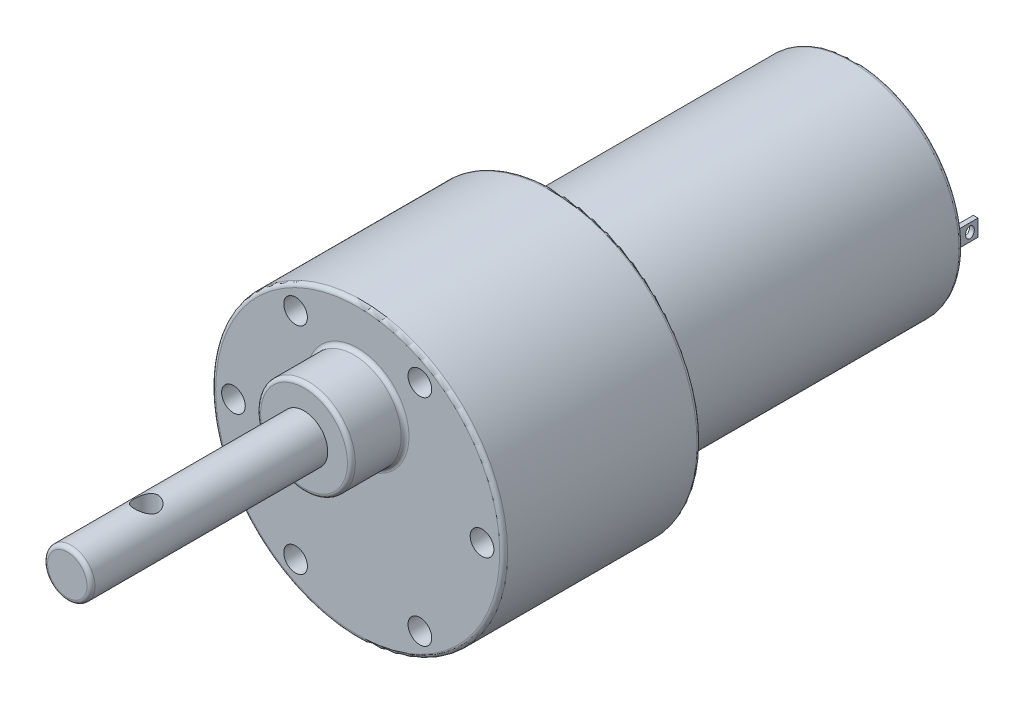
from build123d import *

# Parameters (mm, degrees)
SKETCH1_R           = 18.5
BOSS_EXTRUDE1_DEPTH = 25
SKETCH2_R           = 6
BOSS_EXTRUDE2_DEPTH = 6.8
SKETCH3_R           = 3
BOSS_EXTRUDE3_DEPTH = 30
SKETCH4_R           = 13.7
BOSS_EXTRUDE4_DEPTH = 38
SKETCH5_R           = 5
BOSS_EXTRUDE5_DEPTH = 2
SKETCH6_R           = 1.5
BOSS_EXTRUDE6_DEPTH = 1
SKETCH7_W           = 0.6
SKETCH7_H           = 2.112909024
BOSS_EXTRUDE7_DEPTH = 3
SKETCH9_RX          = 0.703104286
SKETCH9_RY          = 0.549037665
CUT_EXTRUDE1_DEPTH  = 3
SKETCH10_RX         = 0.71543089
SKETCH10_RY         = 0.482234279
CUT_EXTRUDE2_DEPTH  = 3
SKETCH11_R          = 1.5
CUT_EXTRUDE3_DEPTH  = 68.109909849
SKETCH12_R          = 1.5
CUT_EXTRUDE4_DEPTH  = 3
FILLET1_R           = 0.5
FILLET2_R           = 0.5
FILLET3_R           = 0.5
FILLET4_R           = 0.5
FILLET5_R           = 0.5


with BuildPart() as part:
    # Sketch1 → Boss-Extrude1 (new body)
    with BuildSketch(Plane.XY):
        Circle(SKETCH1_R)
    extrude(amount=BOSS_EXTRUDE1_DEPTH)

    # Sketch2 → Boss-Extrude2 (add)
    with BuildSketch(Plane.XY.offset(25)):
        with Locations((0, 7)):
            Circle(SKETCH2_R)
    extrude(amount=BOSS_EXTRUDE2_DEPTH)

    # Sketch3 → Boss-Extrude3 (add)
    with BuildSketch(Plane.XY.offset(31.8)):
        with Locations((0, 7)):
            Circle(SKETCH3_R)
    extrude(amount=BOSS_EXTRUDE3_DEPTH)

    # Sketch4 → Boss-Extrude4 (add)
    with BuildSketch(Plane(origin=(0, 0, 0), x_dir=(-1, 0, 0), z_dir=(0, 0, -1))):
        with Locations(Location((0, 0, 0), (0, 0, 180))):
            Circle(SKETCH4_R)
    extrude(amount=BOSS_EXTRUDE4_DEPTH)

    # Sketch5 → Boss-Extrude5 (add)
    with BuildSketch(Plane(origin=(0, 0, -38), x_dir=(-1, 0, 0), z_dir=(0, 0, -1))):
        Circle(SKETCH5_R)
    extrude(amount=BOSS_EXTRUDE5_DEPTH)

    # Sketch6 → Boss-Extrude6 (add)
    with BuildSketch(Plane(origin=(0, 0, -40), x_dir=(-1, 0, 0), z_dir=(0, 0, -1))):
        Circle(SKETCH6_R)
    extrude(amount=BOSS_EXTRUDE6_DEPTH)

    # Sketch7 → Boss-Extrude7 (add)
    with BuildSketch(Plane(origin=(0, 0, -38), x_dir=(-1, 0, 0), z_dir=(0, 0, -1))):
        with Locations((-12.3, 0)):
            Rectangle(SKETCH7_W, SKETCH7_H)
        with Locations((12.3, 0)):
            Rectangle(SKETCH7_W, SKETCH7_H)
    extrude(amount=BOSS_EXTRUDE7_DEPTH)

    # Sketch9 → Cut-Extrude1 (cut)
    with BuildSketch(Plane(origin=(12.6, 0, 0), x_dir=(0, 0, -1), z_dir=(1, 0, 0))):
        with Locations(Location((39.979491876, 0), (0, 0, 90))):
            Ellipse(SKETCH9_RX, SKETCH9_RY)
    extrude(amount=-CUT_EXTRUDE1_DEPTH, mode=Mode.SUBTRACT)

    # Sketch10 → Cut-Extrude2 (cut)
    with BuildSketch(Plane.ZY.offset(12.6)):
        with Locations(Location((-39.916631896, 0), (0, 0, 90))):
            Ellipse(SKETCH10_RX, SKETCH10_RY)
    extrude(amount=-CUT_EXTRUDE2_DEPTH, mode=Mode.SUBTRACT)

    # Sketch11 → Cut-Extrude3 (cut, through all)
    with BuildSketch(Plane(origin=(0, 0, 0), x_dir=(1, 0, 0), z_dir=(0, 1, 0))):
        with Locations(Location((0, -51.8, 0), (0, 0, 90))):
            Circle(SKETCH11_R)
    extrude(amount=CUT_EXTRUDE3_DEPTH, mode=Mode.SUBTRACT)

    # Sketch12 → Cut-Extrude4 (cut)
    with BuildSketch(Plane.XY.offset(25)):
        with Locations((-15.749852276, 0)):
            Circle(SKETCH12_R)
        with Locations((-7.874852276, 13.63990011)):
            Circle(SKETCH12_R)
        with Locations((7.875147724, 13.63990011)):
            Circle(SKETCH12_R)
        with Locations((15.750147724, 0)):
            Circle(SKETCH12_R)
        with Locations((7.875147724, -13.63990011)):
            Circle(SKETCH12_R)
        with Locations((-7.874852276, -13.63990011)):
            Circle(SKETCH12_R)
    extrude(amount=-CUT_EXTRUDE4_DEPTH, mode=Mode.SUBTRACT)

    # Fillet1
    fillet1_edges = [part.edges().sort_by_distance(p)[0] for p in [
        (-18.5, 0, 25),
    ]]
    fillet(fillet1_edges, radius=FILLET1_R)

    # Fillet2
    fillet2_edges = [part.edges().sort_by_distance(p)[0] for p in [
        (-6, 7, 25),
    ]]
    fillet(fillet2_edges, radius=FILLET2_R)

    # Fillet3
    fillet3_edges = [part.edges().sort_by_distance(p)[0] for p in [
        (-6, 7, 31.8),
    ]]
    fillet(fillet3_edges, radius=FILLET3_R)

    # Fillet4
    fillet4_edges = [part.edges().sort_by_distance(p)[0] for p in [
        (-3, 7, 61.8),
    ]]
    fillet(fillet4_edges, radius=FILLET4_R)

    # Fillet5
    fillet5_edges = [part.edges().sort_by_distance(p)[0] for p in [
        (-13.7, 0, -38),
        (-18.5, 0, 0),
        (5, 0, -38),
        (5, 0, -40),
        (1.5, 0, -41),
    ]]
    fillet(fillet5_edges, radius=FILLET5_R)


solid = part.part
